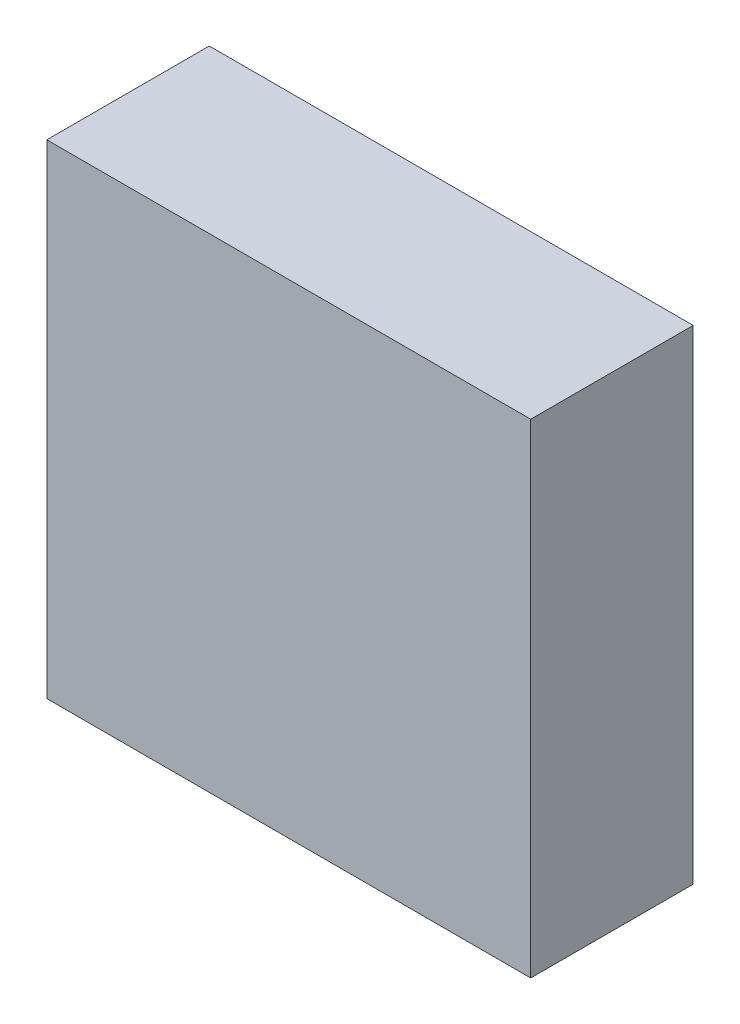
from build123d import *

# Parameters (mm, degrees)
SKETCH1_W      = 8.34
SKETCH1_H      = 8.34
ENVELOPE_DEPTH = 2.8


with BuildPart() as part:
    # Sketch1 → Envelope (new body)
    with BuildSketch(Plane.XY):
        Rectangle(SKETCH1_W, SKETCH1_H)
    extrude(amount=ENVELOPE_DEPTH)


solid = part.part
